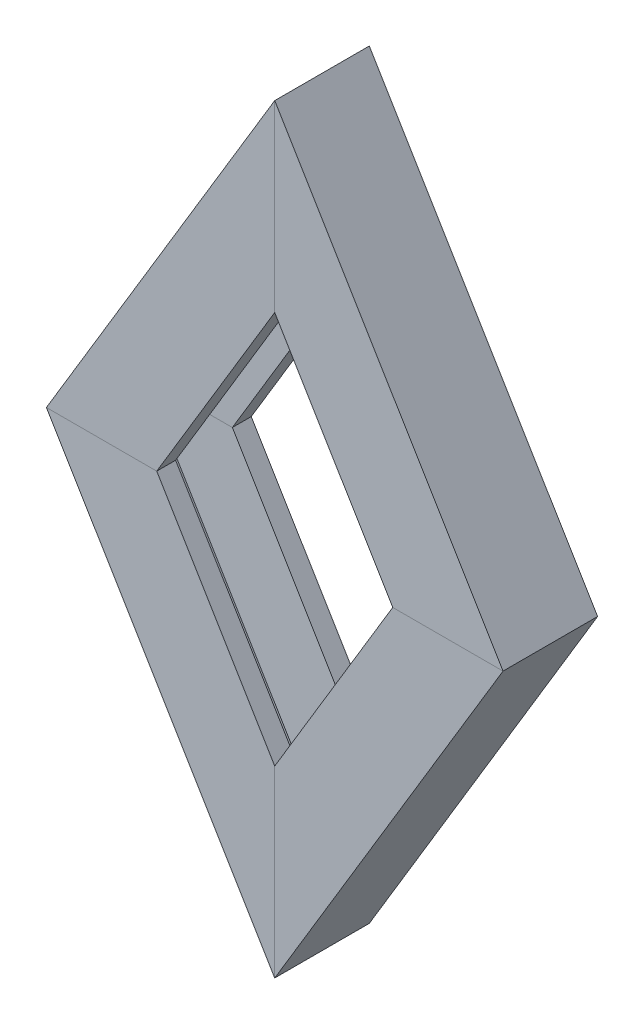
from build123d import *

# Parameters (mm, degrees)
BUILDING_C_CHANEL_1_DEPTH      = 237.634840541
BUILDING_C_CHANEL_1_DEPTH_BACK = 22.24591464
BUILDING_C_CHANEL_1_2_DEPTH    = 259.880755181
BUILDING_C_CHANEL_1_3_DEPTH    = 259.880755181
BUILDING_C_CHANEL_1_4_DEPTH    = 259.880755181


with BuildPart() as part:
    # Sketch2 → Building C CHANEL(1) (new, two sides: drawn at the far end of the back side and taken through both)
    with BuildSketch(Plane(origin=(-91.581002397, 152.4, 0), x_dir=(0, 0, 1), z_dir=(0.5150787536377126, 0.8571428571428572, 0)).offset(-BUILDING_C_CHANEL_1_DEPTH_BACK)):
        Polygon((-25, 25), (-25, -25), (25, -25), (25, 25), (15, 25), (15, -15), (-15, -15), (-15, 25), align=None)
    extrude(amount=BUILDING_C_CHANEL_1_DEPTH + BUILDING_C_CHANEL_1_DEPTH_BACK)

    # Building C CHANEL(1) mitre 1
    split(bisect_by=Plane(origin=(-91.581002397, 152.4, 0), x_dir=(-1, 0, 0), z_dir=(0, 1, 0)), keep=Keep.TOP)

    # Building C CHANEL(1) mitre 2
    split(bisect_by=Plane(origin=(0, 304.8, 0), x_dir=(0, -1, 0), z_dir=(-1, 0, 0)), keep=Keep.TOP)


with BuildPart() as body_2:
    # Sketch2 on segment 2 (carried to segment 2) → Building C CHANEL_1 2 (new body)
    with BuildSketch(Plane(origin=(-30.81965509, 356.087006178, 0), x_dir=(0, 0, 1), z_dir=(0.515078754, -0.857142857, 0))):
        Polygon((-25, 25), (-25, -25), (25, -25), (25, 25), (15, 25), (15, -15), (-15, -15), (-15, 25), align=None)
    extrude(amount=BUILDING_C_CHANEL_1_2_DEPTH)

    # Building C CHANEL_1 2 mitre 1
    split(bisect_by=Plane(origin=(0, 304.8, 0), x_dir=(0, 1, 0), z_dir=(1, 0, 0)), keep=Keep.TOP)

    # Building C CHANEL_1 2 mitre 2
    split(bisect_by=Plane(origin=(91.581002397, 152.4, 0), x_dir=(-1, 0, 0), z_dir=(0, 1, 0)), keep=Keep.TOP)


with BuildPart() as body_3:
    # Sketch2 on segment 3 (carried to segment 3) → Building C CHANEL_1 3 (new body)
    with BuildSketch(Plane(origin=(103.039400383, 171.467926834, 0), x_dir=(0, 0, 1), z_dir=(-0.515078754, -0.857142857, 0))):
        Polygon((-25, 25), (-25, -25), (25, -25), (25, 25), (15, 25), (15, -15), (-15, -15), (-15, 25), align=None)
    extrude(amount=BUILDING_C_CHANEL_1_3_DEPTH)

    # Building C CHANEL_1 3 mitre 1
    split(bisect_by=Plane(origin=(91.581002397, 152.4, 0), x_dir=(1, 0, 0), z_dir=(0, -1, 0)), keep=Keep.TOP)

    # Building C CHANEL_1 3 mitre 2
    split(bisect_by=Plane.YZ, keep=Keep.TOP)


with BuildPart() as body_4:
    # Sketch2 on segment 4 (carried to segment 4) → Building C CHANEL_1 4 (new body)
    with BuildSketch(Plane(origin=(30.81965509, -51.287006178, 0), x_dir=(0, 0, 1), z_dir=(-0.515078754, 0.857142857, 0))):
        Polygon((-25, 25), (-25, -25), (25, -25), (25, 25), (15, 25), (15, -15), (-15, -15), (-15, 25), align=None)
    extrude(amount=BUILDING_C_CHANEL_1_4_DEPTH)

    # Building C CHANEL_1 4 mitre 1
    split(bisect_by=Plane(origin=(0, 0, 0), x_dir=(0, -1, 0), z_dir=(-1, 0, 0)), keep=Keep.TOP)

    # Building C CHANEL_1 4 mitre 2
    split(bisect_by=Plane(origin=(-91.581002397, 152.4, 0), x_dir=(1, 0, 0), z_dir=(0, -1, 0)), keep=Keep.TOP)


solid = Compound([part.part, body_2.part, body_3.part, body_4.part])
